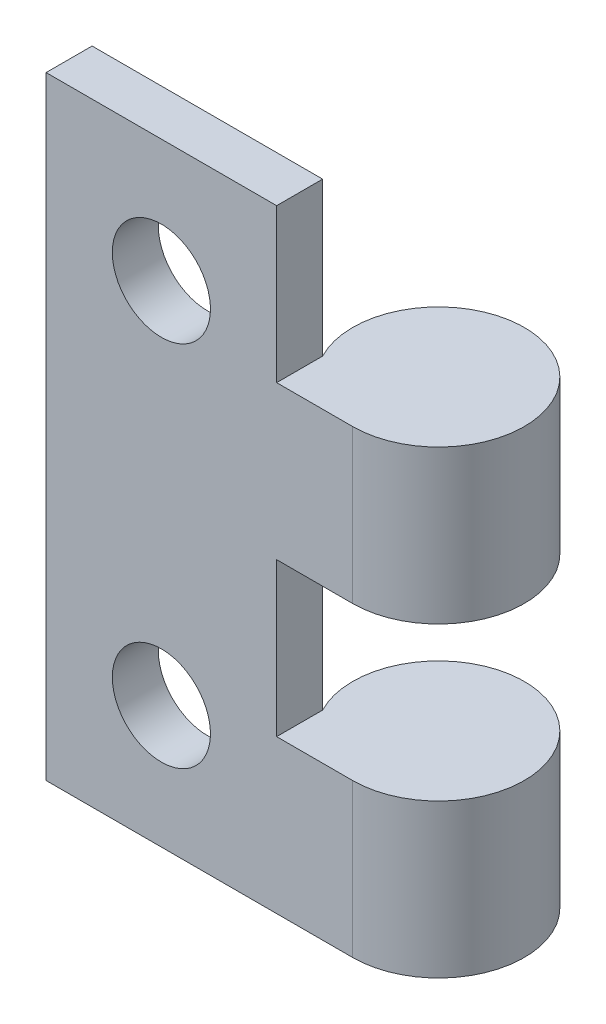
from build123d import *

# Parameters (mm, degrees)
EXTRUDE_2_DEPTH     = 20
SKETCH_4_W          = 4.1
SKETCH_4_H          = 5
CUT_EXTRUDE_1_DEPTH = 23
SKETCH_5_W          = 4.959838708
SKETCH_5_H          = 5
CUT_EXTRUDE_2_DEPTH = 23
SKETCH_6_R          = 1.6
CUT_EXTRUDE_3_DEPTH = 23


with BuildPart() as part:
    # 草图1 → 凸台-拉伸2 (new body)
    with BuildSketch(Plane(origin=(0, 0, 0), x_dir=(1, 0, 0), z_dir=(0, 1, 0))):
        with BuildLine():
            ThreePointArc((2.520080646, 0.75), (3.550862325, -0.34582971), (5, -0.75))
            Line((5, -0.75), (5, 0.75))
            Line((5, 0.75), (2.520080646, 0.75))
        make_face()
        with BuildLine():
            Line((5, 0.75), (5, -0.75))
            ThreePointArc((5, -0.75), (6.979898987, 0.070101013), (7.8, 2.05))
            ThreePointArc((7.8, 2.05), (4.330587642, 4.768802511), (2.520080646, 0.75))
            Line((2.520080646, 0.75), (5, 0.75))
        make_face()
        with BuildLine():
            ThreePointArc((2.520080646, 0.75), (3.550862325, -0.34582971), (5, -0.75))
            Line((5, -0.75), (5, 0.75))
            Line((5, 0.75), (2.520080646, 0.75))
        make_face()
        with BuildLine():
            Line((5, 0.75), (5, -0.75))
            ThreePointArc((5, -0.75), (6.979898987, 0.070101013), (7.8, 2.05))
            ThreePointArc((7.8, 2.05), (4.330587642, 4.768802511), (2.520080646, 0.75))
            Line((2.520080646, 0.75), (5, 0.75))
        make_face()
        with BuildLine():
            Line((-5, 0.75), (-5, -0.75))
            Line((-5, -0.75), (5, -0.75))
            ThreePointArc((5, -0.75), (3.550862325, -0.34582971), (2.520080646, 0.75))
            Line((2.520080646, 0.75), (-5, 0.75))
        make_face()
    extrude(amount=EXTRUDE_2_DEPTH)

    # 草图4 → 切除-拉伸1 (cut)
    with BuildSketch(Plane.ZY.offset(5)):
        with Locations((-2.8, 17.5)):
            Rectangle(SKETCH_4_W, SKETCH_4_H)
        with Locations((-2.8, 7.5)):
            Rectangle(SKETCH_4_W, SKETCH_4_H)
    extrude(amount=-CUT_EXTRUDE_1_DEPTH, mode=Mode.SUBTRACT)

    # 草图5 → 切除-拉伸2 (cut)
    with BuildSketch(Plane(origin=(0, 0, -0.75), x_dir=(-1, 0, 0), z_dir=(0, 0, -1))):
        with Locations((-5, 7.5)):
            Rectangle(SKETCH_5_W, SKETCH_5_H)
        with Locations((-5, 17.5)):
            Rectangle(SKETCH_5_W, SKETCH_5_H)
    extrude(amount=-CUT_EXTRUDE_2_DEPTH, mode=Mode.SUBTRACT)

    # 草图6 → 切除-拉伸3 (cut)
    with BuildSketch(Plane(origin=(0, 0, -0.75), x_dir=(-1, 0, 0), z_dir=(0, 0, -1))):
        with Locations((1.239959677, 16)):
            Circle(SKETCH_6_R)
        with Locations((1.239959677, 4)):
            Circle(SKETCH_6_R)
    extrude(amount=-CUT_EXTRUDE_3_DEPTH, mode=Mode.SUBTRACT)


solid = part.part
